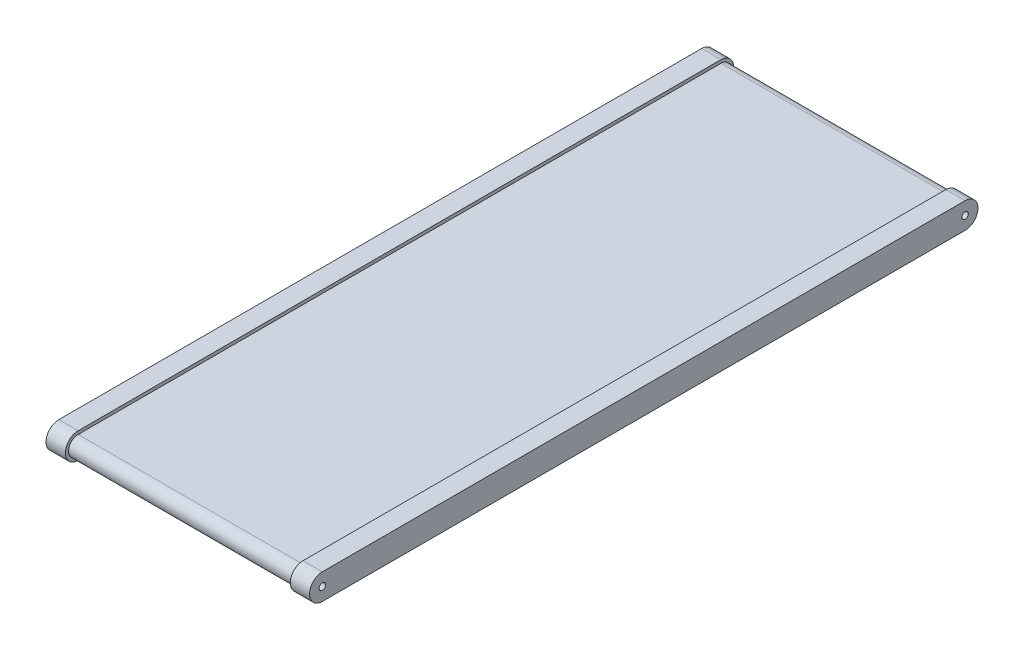
from build123d import *

# Parameters (mm, degrees)
BOSS_EXTRUDE1_DEPTH = 350
BOSS_EXTRUDE2_DEPTH = 30
LPATTERN1_COUNT     = 2
LPATTERN1_PITCH     = 380
SKETCH3_R           = 5
CUT_EXTRUDE1_DEPTH  = 1100.874992897


with BuildPart() as part:
    # Sketch1 → Boss-Extrude1 (new body)
    with BuildSketch(Plane(origin=(0, 0, 0), x_dir=(0, 0, -1), z_dir=(1, 0, 0))):
        with BuildLine():
            Line((1000, 30), (0, 30))
            ThreePointArc((0, 30), (-15, 15), (0, 0))
            Line((0, 0), (1000, 0))
            ThreePointArc((1000, 0), (1015, 15), (1000, 30))
        make_face()
    extrude(amount=BOSS_EXTRUDE1_DEPTH)

    # Sketch2 → Boss-Extrude2 (add)
    with BuildSketch(Plane(origin=(350, 0, 0), x_dir=(0, 0, -1), z_dir=(1, 0, 0))):
        with BuildLine():
            Line((0, -5), (1000, -5))
            ThreePointArc((1000, -5), (1020, 15), (1000, 35))
            Line((1000, 35), (0, 35))
            ThreePointArc((0, 35), (-20, 15), (0, -5))
        make_face()
    boss_extrude2 = extrude(amount=BOSS_EXTRUDE2_DEPTH)

    # LPattern1: Boss-Extrude2 ×2
    with Locations(*[(-i * LPATTERN1_PITCH, 0, 0) for i in range(1, LPATTERN1_COUNT)]):
        add(boss_extrude2)

    # Sketch3 → Cut-Extrude1 (cut, through all)
    with BuildSketch(Plane(origin=(380, 0, 0), x_dir=(0, 0, -1), z_dir=(1, 0, 0))):
        with Locations((0, 15)):
            Circle(SKETCH3_R)
        with Locations((1000, 15)):
            Circle(SKETCH3_R)
    extrude(amount=-CUT_EXTRUDE1_DEPTH, mode=Mode.SUBTRACT)


solid = part.part
